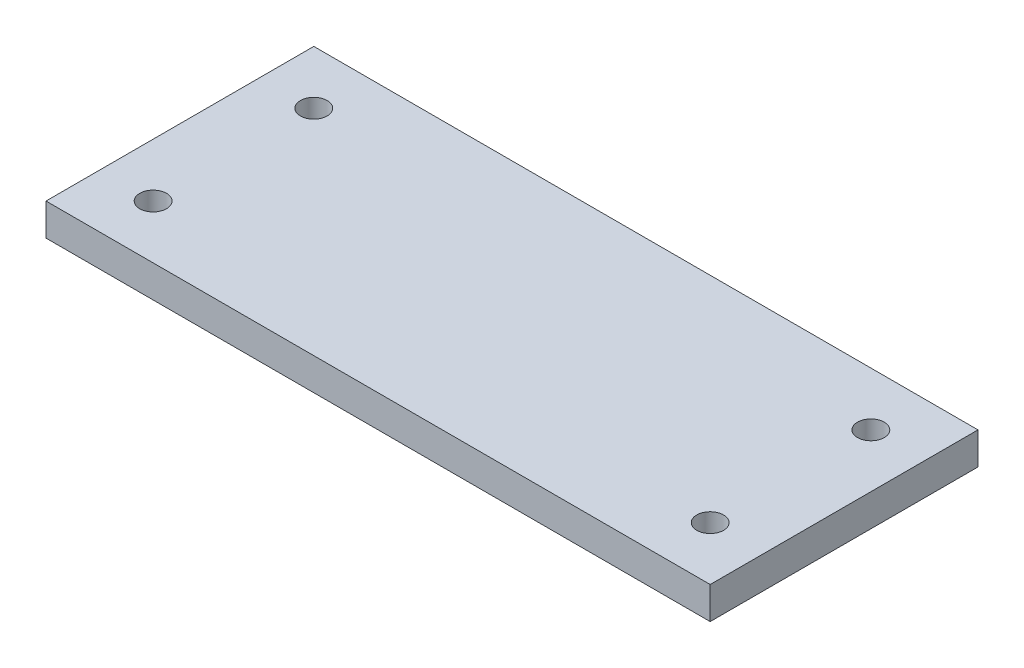
from build123d import *

# Parameters (mm, degrees)
SZKIC1_W                    = 62
SZKIC1_H                    = 25
DODANIE_WYCI_GNI_CIE1_DEPTH = 3
SZKIC2_R                    = 1.25
WYTNIJ_WYCI_GNI_CIE1_DEPTH  = 5


with BuildPart() as part:
    # Szkic1 → Dodanie-wyciągnięcie1 (new body)
    with BuildSketch(Plane(origin=(0, 0, 0), x_dir=(1, 0, 0), z_dir=(0, 1, 0))):
        with Locations((31, 12.5)):
            Rectangle(SZKIC1_W, SZKIC1_H)
    extrude(amount=DODANIE_WYCI_GNI_CIE1_DEPTH)

    # Szkic2 → Wytnij-wyciągnięcie1 (cut)
    with BuildSketch(Plane(origin=(0, 3, 0), x_dir=(1, 0, 0), z_dir=(0, 1, 0))):
        with Locations(Location((5, 5, 0), (0, 0, 270))):
            Circle(SZKIC2_R)
        with Locations(Location((57, 5, 0), (0, 0, 270))):
            Circle(SZKIC2_R)
        with Locations(Location((57, 20, 0), (0, 0, 270))):
            Circle(SZKIC2_R)
        with Locations(Location((5, 20, 0), (0, 0, 270))):
            Circle(SZKIC2_R)
    extrude(amount=-WYTNIJ_WYCI_GNI_CIE1_DEPTH, mode=Mode.SUBTRACT)


solid = part.part
